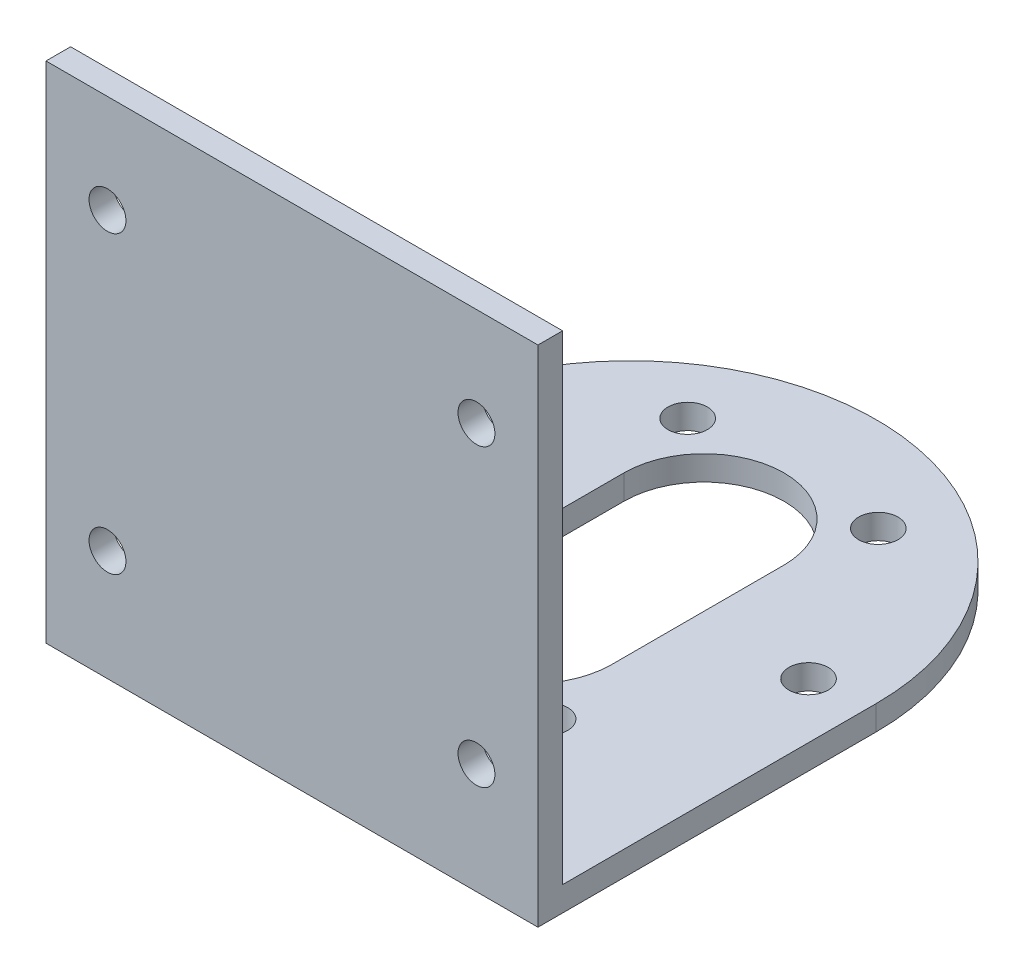
from build123d import *

# Parameters (mm, degrees)
SKETCH_1_R          = 1.6
EXTRUDE_1_DEPTH     = 2
SKETCH_2_W          = 40
SKETCH_2_H          = 2
EXTRUDE_2_DEPTH     = 39
SKETCH_3_R          = 1.5
CUT_EXTRUDE_1_DEPTH = 66.064678839


with BuildPart() as part:
    # 草图1 → 凸台-拉伸1 (new body)
    with BuildSketch(Plane(origin=(0, 0, 0), x_dir=(1, 0, 0), z_dir=(0, 1, 0))):
        with BuildLine():
            Line((-21.958197384, -2.164323425), (-21.958197384, -29.664323425))
            Line((-21.958197384, -29.664323425), (18.041802616, -29.664323425))
            Line((18.041802616, -29.664323425), (18.041802616, -2.164323425))
            ThreePointArc((18.041802616, -2.164323425), (-1.958197384, 17.835676575), (-21.958197384, -2.164323425))
        make_face()
        with Locations(Location((-9.708197384, 10.259070334, 0), (0, 0, 270))):
            Circle(SKETCH_1_R, mode=Mode.SUBTRACT)
        with Locations(Location((-17.458197384, -3.164323425, 0), (0, 0, 270))):
            Circle(SKETCH_1_R, mode=Mode.SUBTRACT)
        with Locations(Location((-9.708197384, -16.587717183, 0), (0, 0, 270))):
            Circle(SKETCH_1_R, mode=Mode.SUBTRACT)
        with Locations(Location((5.791802616, -16.587717183, 0), (0, 0, 270))):
            Circle(SKETCH_1_R, mode=Mode.SUBTRACT)
        with Locations(Location((13.541802616, -3.164323425, 0), (0, 0, 270))):
            Circle(SKETCH_1_R, mode=Mode.SUBTRACT)
        with Locations(Location((5.791802616, 10.259070334, 0), (0, 0, 270))):
            Circle(SKETCH_1_R, mode=Mode.SUBTRACT)
        with BuildLine():
            Line((4.541802616, 3.835676575), (4.541802616, -10.164323425))
            ThreePointArc((4.541802616, -10.164323425), (-1.958197384, -16.664323425), (-8.458197384, -10.164323425))
            Line((-8.458197384, -10.164323425), (-8.458197384, 3.835676575))
            ThreePointArc((-8.458197384, 3.835676575), (-1.958197384, 10.335676575), (4.541802616, 3.835676575))
        make_face(mode=Mode.SUBTRACT)
    extrude(amount=EXTRUDE_1_DEPTH)

    # 草图2 → 凸台-拉伸2 (add)
    with BuildSketch(Plane(origin=(0, 2, 0), x_dir=(1, 0, 0), z_dir=(0, 1, 0))):
        with Locations((-1.958197384, -28.664323425)):
            Rectangle(SKETCH_2_W, SKETCH_2_H)
    extrude(amount=EXTRUDE_2_DEPTH)

    # 草图3 → 切除-拉伸1 (cut, through all)
    with BuildSketch(Plane(origin=(0, 0, 27.664323425), x_dir=(-1, 0, 0), z_dir=(0, 0, -1))):
        with Locations((-13.041802616, 33)):
            Circle(SKETCH_3_R)
        with Locations((-13.041802616, 9)):
            Circle(SKETCH_3_R)
        with Locations((16.958197384, 33)):
            Circle(SKETCH_3_R)
        with Locations((16.958197384, 9)):
            Circle(SKETCH_3_R)
    extrude(amount=-CUT_EXTRUDE_1_DEPTH, mode=Mode.SUBTRACT)


solid = part.part
